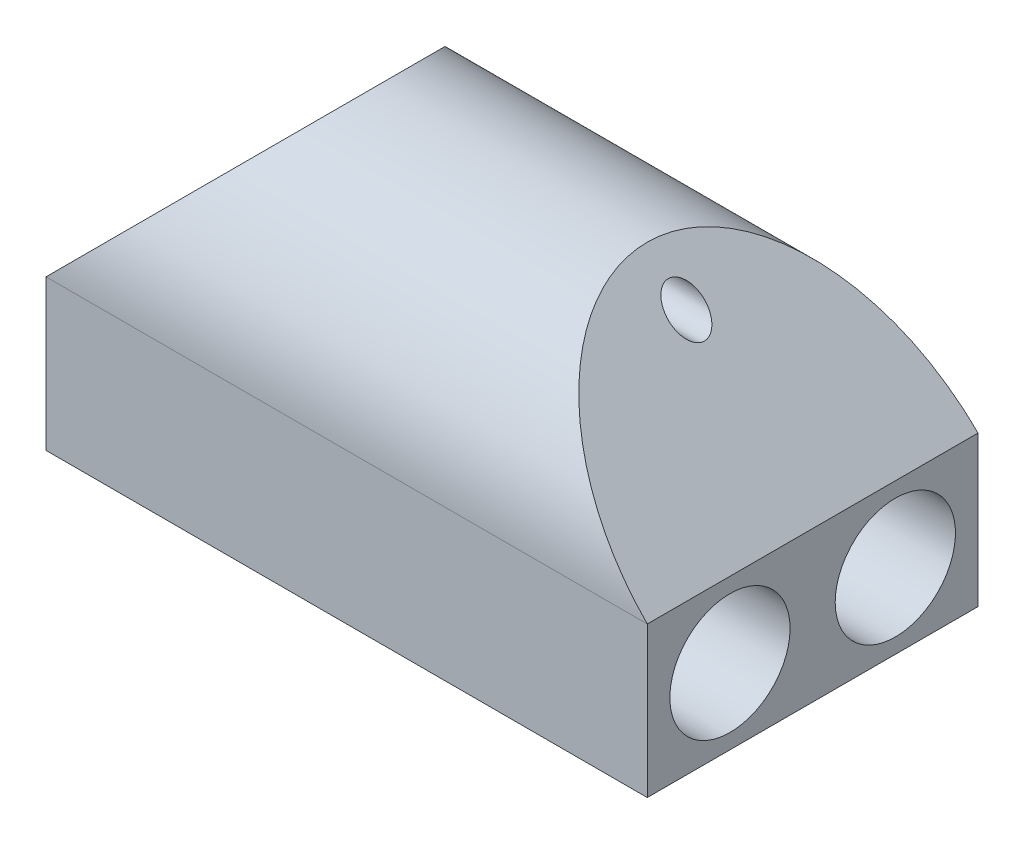
from build123d import *

# Parameters (mm, degrees)
SKETCH1_W              = 25.4
SKETCH1_H              = 13.97
DEPTH_A_DEPTH          = 6.35
ROUND_EXTRUDE_DEPTH    = 25.4
ANGLE_CUT_DEPTH        = 32.908355097
STRING_HOLE_R          = 0.762
STRING_HOLE_CUT_DEPTH  = 32.908355097
ELASTIC_HOLES_R        = 2.54
ELASTIC_HOLE_CUT_DEPTH = 32.908355097


with BuildPart() as part:
    # Sketch1 → depth a (new body)
    with BuildSketch(Plane(origin=(0, 0, 0), x_dir=(1, 0, 0), z_dir=(0, 1, 0))):
        with Locations((-12.7, 6.985)):
            Rectangle(SKETCH1_W, SKETCH1_H)
    extrude(amount=DEPTH_A_DEPTH)

    # Sketch4 → round extrude (add)
    with BuildSketch(Plane(origin=(0, 0, 0), x_dir=(0, 0, -1), z_dir=(1, 0, 0))):
        with BuildLine():
            Line((0, 6.35), (13.97, 6.35))
            ThreePointArc((13.97, 6.35), (6.985, 13.335), (0, 6.35))
        make_face()
    extrude(amount=-ROUND_EXTRUDE_DEPTH)

    # Sketch5 → angle cut (cut, through all)
    with BuildSketch(Plane.XY):
        Polygon((0, 6.35), (0, 13.335), (-6.985, 13.335), align=None)
        Polygon((-25.4, 6.35), (-25.4, 13.335), (-18.415, 13.335), align=None)
    extrude(amount=-ANGLE_CUT_DEPTH, mode=Mode.SUBTRACT)

    # string hole → string hole cut (cut, through all)
    with BuildSketch(Plane(origin=(0, 0, 0), x_dir=(0, 0, -1), z_dir=(1, 0, 0))):
        with Locations(Location((6.985, 11.684, 0), (0, 0, 270))):
            Circle(STRING_HOLE_R)
    extrude(amount=-STRING_HOLE_CUT_DEPTH, mode=Mode.SUBTRACT)

    # elastic holes → elastic hole cut (cut, through all)
    with BuildSketch(Plane(origin=(0, 0, 0), x_dir=(0, 0, -1), z_dir=(1, 0, 0))):
        with Locations((3.4925, 3.175)):
            Circle(ELASTIC_HOLES_R)
        with Locations(Location((10.4775, 3.175, 0), (0, 0, 180))):
            Circle(ELASTIC_HOLES_R)
    extrude(amount=-ELASTIC_HOLE_CUT_DEPTH, mode=Mode.SUBTRACT)


solid = part.part
